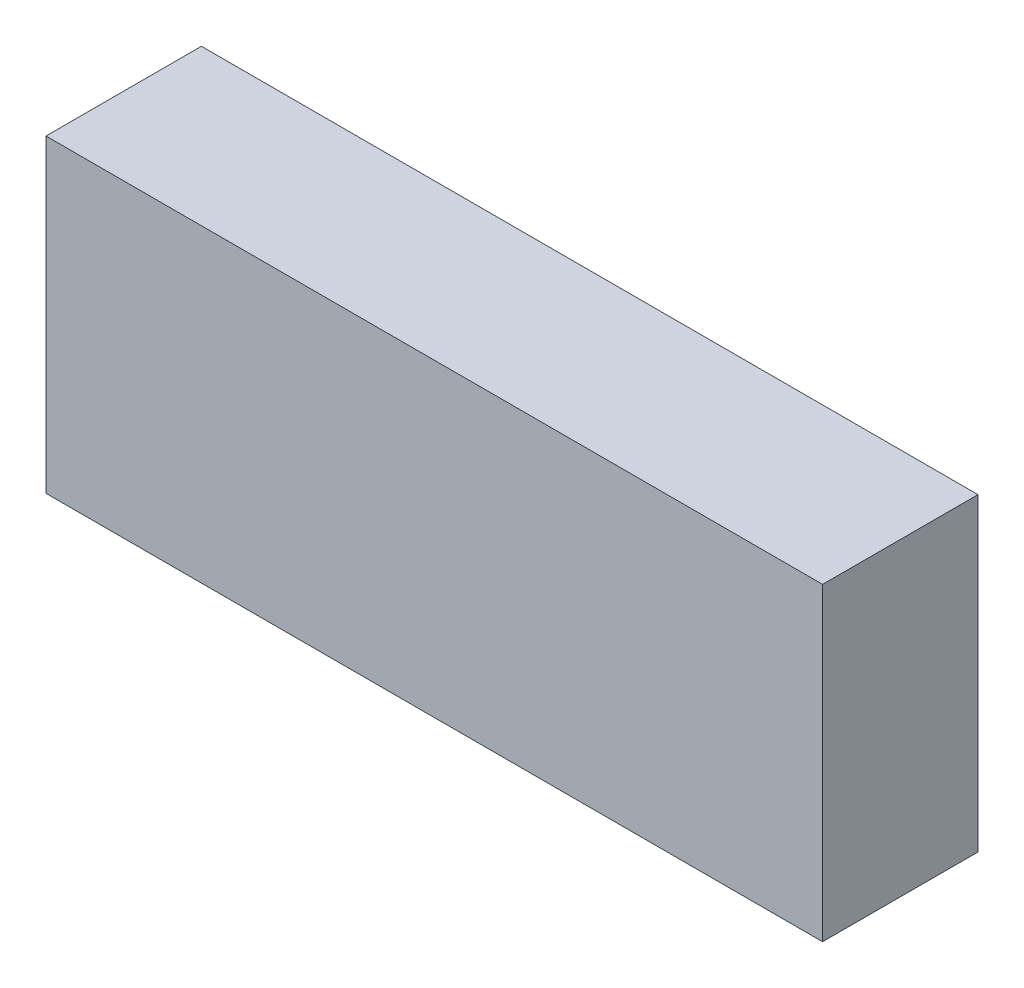
from build123d import *

# Parameters (mm, degrees)
SKETCH1_W               = 4.9968
SKETCH1_H               = 1.9914
COMPONENT_OUTLINE_DEPTH = 1


with BuildPart() as part:
    # Sketch1 → Component_Outline (new body)
    with BuildSketch(Plane.XY):
        with Locations((0, 0.0127)):
            Rectangle(SKETCH1_W, SKETCH1_H)
    extrude(amount=COMPONENT_OUTLINE_DEPTH)


solid = part.part
